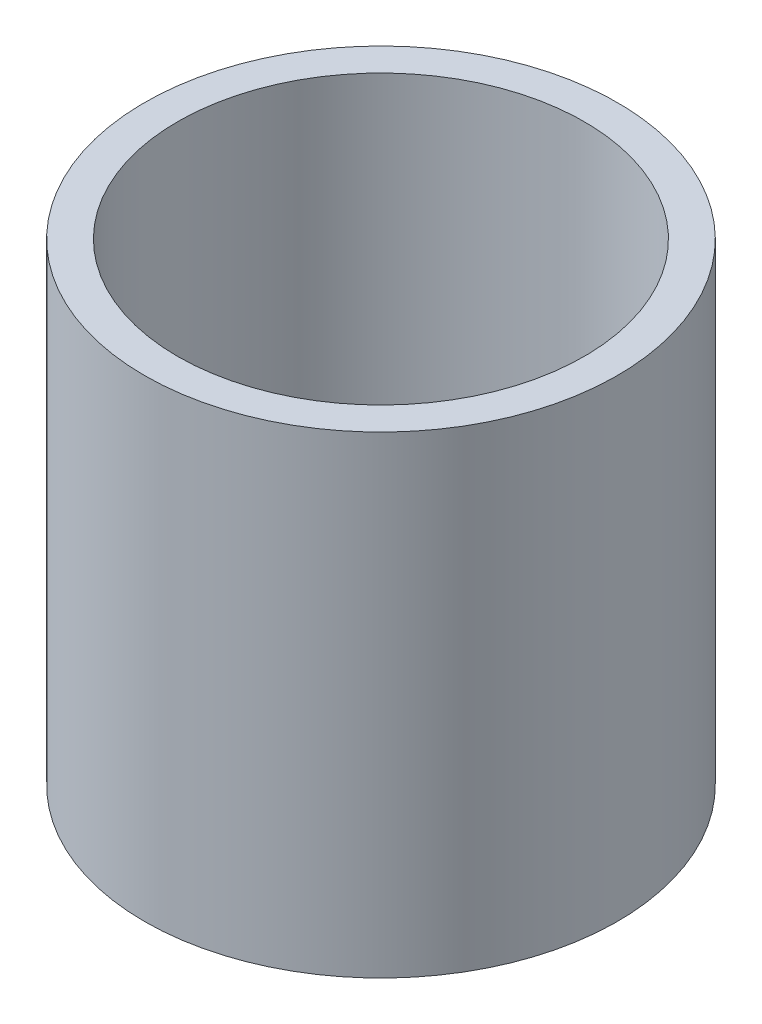
from build123d import *

# Parameters (mm, degrees)
SKETCH1_R           = 50
BOSS_EXTRUDE1_DEPTH = 100
SKETCH3_R           = 43
CUT_EXTRUDE2_DEPTH  = 123.474487139


with BuildPart() as part:
    # Sketch1 → Boss-Extrude1 (new body)
    with BuildSketch(Plane(origin=(0, 0, 0), x_dir=(1, 0, 0), z_dir=(0, 1, 0))):
        with Locations(Location((0, 0, 0), (0, 0, 270))):
            Circle(SKETCH1_R)
    extrude(amount=BOSS_EXTRUDE1_DEPTH)

    # Sketch3 → Cut-Extrude2 (cut, through all)
    with BuildSketch(Plane(origin=(0, 100, 0), x_dir=(1, 0, 0), z_dir=(0, 1, 0))):
        with Locations(Location((0, 0, 0), (0, 0, 270))):
            Circle(SKETCH3_R)
    extrude(amount=-CUT_EXTRUDE2_DEPTH, mode=Mode.SUBTRACT)


solid = part.part
